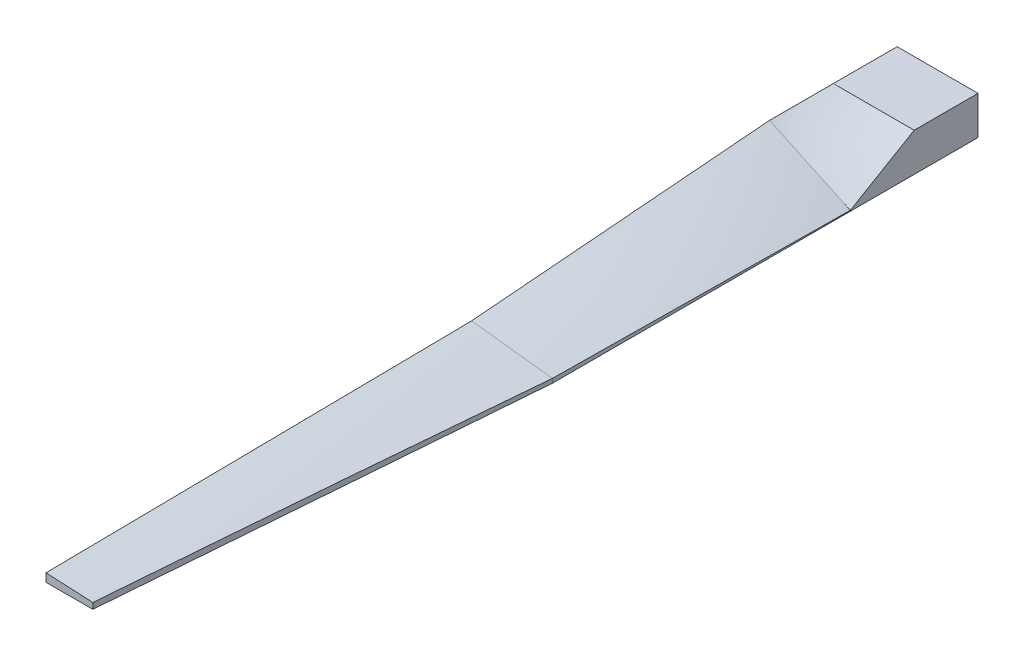
from build123d import *

# Parameters (mm, degrees)
CUT_EXTRUDE2_DEPTH      = 1006.50982105
CUT_EXTRUDE2_DEPTH_BACK = 1006.50982105


with BuildPart() as part:
    # Sketch1 → Loft3 section 0
    with BuildSketch(Plane.XY):
        with BuildLine():
            Line((0, 0), (95, 0))
            Line((95, 0), (95, 45))
            Line((95, 45), (0, 45))
            Line((0, 45), (0, 0))
        make_face()
    # Sketch2 → Loft3 section 1
    with BuildSketch(Plane.XY.offset(75)):
        with BuildLine():
            Line((0, 0), (95, 0))
            Line((95, 0), (95, 45))
            Line((95, 45), (0, 45))
            Line((0, 45), (0, 0))
        make_face()
    loft()

    # Sketch3 → section 1 of loft4
    with BuildSketch(Plane.XY.offset(150), mode=Mode.PRIVATE) as loft4_s1:
        with BuildLine():
            Line((0, 0), (0, 45))
            Line((0, 45), (95, 1))
            Line((95, 1), (95, 0))
            Line((95, 0), (0, 0))
        make_face()
    # loft from a face of the part (loft4)
    loft([part.faces().sort_by_distance((47.5, 22.5, 75))[0], loft4_s1.sketch])

    # Sketch4 → section 1 of loft5
    with BuildSketch(Plane.XY.offset(500), mode=Mode.PRIVATE) as loft5_s1:
        with BuildLine():
            Line((0, 0), (0, 16))
            Line((0, 16), (95, 5))
            Line((95, 5), (95, 0))
            Line((95, 0), (0, 0))
        make_face()
    # loft from a face of the part (loft5)
    loft([part.faces().sort_by_distance((32.355072464, 15.007246377, 150))[0], loft5_s1.sketch])

    # Sketch6 → section 1 of loft6
    with BuildSketch(Plane.XY.offset(1000), mode=Mode.PRIVATE) as loft6_s1:
        with BuildLine():
            Line((0, 0), (0, 9.669407938))
            Line((0, 9.669407938), (95, 5))
            Line((95, 5), (95, 0))
            Line((95, 0), (0, 0))
        make_face()
    # loft from a face of the part (loft6)
    loft([part.faces().sort_by_distance((39.206349206, 5.73015873, 500))[0], loft6_s1.sketch])

    # Sketch7 → Cut-Extrude2 (cut, two sides: drawn at the far end of the back side and taken through both)
    with BuildSketch(Plane(origin=(0, 0, 0), x_dir=(1, 0, 0), z_dir=(0, 1, 0)).offset(-CUT_EXTRUDE2_DEPTH_BACK)):
        Polygon((55, -1000), (95, -500), (95, -1000), align=None)
    extrude(amount=CUT_EXTRUDE2_DEPTH + CUT_EXTRUDE2_DEPTH_BACK, mode=Mode.SUBTRACT)


solid = part.part
